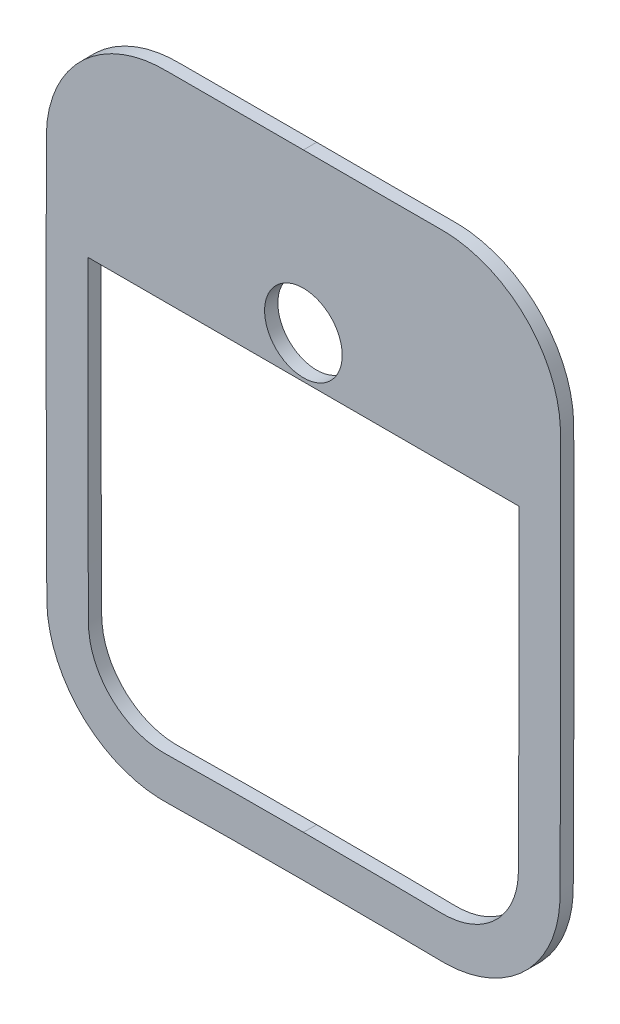
from build123d import *

# Parameters (mm, degrees)
SKETCH_1_R      = 8.2
EXTRUDE_1_DEPTH = 1.4


with BuildPart() as part:
    # Эскиз1 → Бобышка-Вытянуть1 (new, symmetric)
    # profile 1 of 2: a face of its own
    with BuildSketch(Plane.XY):
        with BuildLine():
            add(Edge.make_bspline(
                [(-4.385e-06, 3.477314103), (2.275729164, 3.478174042), (6.827561201, 3.476973512), (13.653105903, 3.440292499), (19.344025952, 3.391861948), (23.890939343, 3.335371796), (26.745660232, 3.303860565), (29.00129781, 3.258870273), (31.368643959, 3.280847467), (34.286491629, 3.648899926), (37.706807786, 4.571513603), (42.042206832, 6.440713344), (46.879953022, 9.901314255), (50.537599605, 14.593753945), (52.579526042, 18.850208453), (53.637220524, 22.234973045), (54.111038279, 25.135298028), (54.225276888, 27.510163809), (54.215390164, 29.778236261), (54.240133301, 32.628290734), (54.257823169, 37.180085377), (54.285075218, 42.87272942), (54.310780929, 49.702787654), (54.339930891, 58.810068537), (54.363104914, 70.194239859), (54.366568245, 81.578467791), (54.358708606, 90.685719503), (54.349162039, 97.516071715), (54.334485436, 103.20797513), (54.328060317, 107.761560094), (54.308811233, 110.606659613), (54.324408142, 112.886642082), (54.194135143, 115.257721943), (53.705013261, 118.157957161), (52.62466034, 121.53452525), (50.554252788, 125.778079082), (46.871486807, 130.445624202), (42.029828738, 133.893421474), (37.700582591, 135.76774794), (34.286491793, 136.703374588), (31.371947713, 137.091049425), (29.008672577, 137.130240387), (26.75376985, 137.112713038), (23.89762622, 137.112770231), (19.349331815, 137.104281948), (13.656648626, 137.103485823), (6.828758745, 137.110737326), (2.276195077, 137.124340079), (1.12e-07, 137.132324706)],
                knots=[-1.403e-06, -1.403e-06, -1.403e-06, -1.403e-06, 0.031249042, 0.062499487, 0.093749932, 0.109375155, 0.125000377, 0.132812988, 0.1406256, 0.156250822, 0.171876045, 0.187501267, 0.218751712, 0.250002158, 0.26562738, 0.281252603, 0.296877825, 0.304690436, 0.312503048, 0.32812827, 0.343753493, 0.375003938, 0.406254383, 0.437504828, 0.500005718, 0.562506609, 0.593757054, 0.625007499, 0.656257944, 0.671883166, 0.687508389, 0.695321, 0.703133611, 0.718758834, 0.734384057, 0.750009279, 0.781259724, 0.812510169, 0.828135392, 0.843760614, 0.859385837, 0.867198448, 0.87501106, 0.890636282, 0.906261505, 0.93751195, 0.968762395, 1.00001284, 1.00001284, 1.00001284, 1.00001284], degree=3))
            add(Edge.make_bspline(
                [(1.12e-07, 137.132324706), (-2.276185426, 137.124340752), (-6.828726159, 137.110744752), (-13.656606089, 137.103457892), (-19.349208462, 137.10436388), (-23.897588817, 137.112625317), (-26.753539522, 137.112932833), (-29.008712264, 137.129920257), (-31.371889119, 137.091250562), (-34.28635234, 136.70332851), (-37.700359545, 135.767848518), (-42.029772945, 133.893467536), (-46.871398793, 130.445729176), (-50.55428945, 125.777966939), (-52.624591575, 121.534611836), (-53.70513162, 118.157582998), (-54.194201592, 115.257651601), (-54.324437606, 112.885963391), (-54.308864544, 110.605865688), (-54.327593372, 107.761624293), (-54.334894059, 103.207477192), (-54.349024698, 97.515902003), (-54.358743316, 90.685462991), (-54.366551769, 81.578292176), (-54.363106097, 70.194087786), (-54.339937065, 58.809981225), (-54.310765845, 49.702710304), (-54.28514198, 42.872756766), (-54.257608847, 37.179931068), (-54.240289723, 32.628480608), (-54.215525939, 29.778361624), (-54.225458708, 27.509257596), (-54.110840518, 25.135839108), (-53.637255477, 22.234868439), (-52.579828848, 18.85130182), (-50.538045421, 14.593912603), (-46.880507021, 9.902159969), (-42.04267942, 6.44089392), (-37.707827157, 4.572078379), (-34.286835279, 3.648708981), (-31.369101111, 3.281392258), (-29.001029802, 3.257925087), (-26.74533221, 3.304228282), (-23.890964379, 3.3355427), (-19.343908429, 3.391749693), (-13.653071795, 3.440339679), (-6.827524402, 3.476942091), (-2.27572566, 3.478198986), (-4.385e-06, 3.477314103)],
                knots=[-1.284e-05, -1.284e-05, -1.284e-05, -1.284e-05, 0.031237605, 0.06248805, 0.093738495, 0.109363718, 0.12498894, 0.132801552, 0.140614163, 0.156239386, 0.171864608, 0.187489831, 0.218740276, 0.249990721, 0.265615943, 0.281241166, 0.296866388, 0.304679, 0.312491611, 0.328116834, 0.343742056, 0.374992501, 0.406242946, 0.437493391, 0.499994282, 0.562495172, 0.593745617, 0.624996062, 0.656246507, 0.67187173, 0.687496952, 0.695309564, 0.703122175, 0.718747397, 0.73437262, 0.749997842, 0.781248288, 0.812498733, 0.828123955, 0.843749178, 0.8593744, 0.867187012, 0.874999623, 0.890624845, 0.906250068, 0.937500513, 0.968750958, 1.000001403, 1.000001403, 1.000001403, 1.000001403], degree=3))
        make_face()
        with BuildLine():
            add(Edge.make_bspline(
                [(-1.124e-06, 128.332270568), (-2.280365613, 128.324272059), (-6.840952372, 128.310772668), (-12.54247003, 128.304473477), (-17.102470136, 128.304321449), (-20.523264106, 128.306743989), (-23.37067067, 128.310496061), (-25.368903885, 128.314343862), (-26.506742002, 128.316832808), (-27.361014138, 128.318797865), (-28.203886411, 128.319851575), (-29.119861379, 128.324220631), (-29.70669642, 128.321454641), (-30.265835712, 128.296280345), (-30.849635682, 128.251162802), (-31.608716707, 128.165017173), (-32.932970792, 127.945188977), (-34.786653205, 127.432872726), (-37.598941607, 126.212459438), (-40.736488176, 123.97204058), (-43.108216264, 120.957761098), (-44.436395269, 118.228034571), (-45.012424743, 116.423394489), (-45.313137049, 114.948092229), (-45.4341262, 114.012134472), (-45.482929754, 113.359443212), (-45.501430806, 112.970994029), (-45.509004812, 112.716591942), (-45.511850815, 112.415737461), (-45.51321122, 111.83855637), (-45.516326707, 110.848732037), (-45.520207457, 109.423684892), (-45.524886348, 107.718360637), (-45.529308036, 106.011951146), (-45.534915418, 103.737254487), (-45.541323411, 100.893798883), (-45.547051991, 97.981927915), (-45.551113999, 95.638800098), (-45.554681534, 93.364239297), (-45.559909161, 89.452403461), (-45.564581633, 83.835093852), (-45.565131683, 77.01255514), (-45.56014737, 70.190613462), (-45.549187131, 63.368807037), (-45.532605469, 56.546287339), (-45.51095078, 49.723370217), (-45.488946454, 44.036906078), (-45.469532783, 39.487306664), (-45.456465453, 36.644300231), (-45.445643146, 34.368669525), (-45.437598421, 32.660679006), (-45.429344739, 30.956269573), (-45.422435335, 29.532980428), (-45.41634537, 28.546524613), (-45.414260609, 27.949648431), (-45.411606391, 27.619401141), (-45.404807721, 27.357013936), (-45.388233834, 26.977548221), (-45.354533552, 26.502908376), (-45.294452504, 25.939793742), (-45.187260504, 25.19126516), (-44.930020155, 23.896193536), (-44.361798981, 22.083233355), (-43.051533958, 19.352124321), (-40.699860395, 16.336632861), (-37.592385393, 14.113257477), (-34.796945869, 12.908970494), (-32.958645932, 12.411113504), (-31.457545368, 12.172674769), (-30.509178938, 12.089466262), (-29.730359526, 12.062276053), (-29.193216609, 12.063494106), (-28.263522102, 12.079294928), (-27.434540192, 12.089709292), (-26.572157763, 12.102080156), (-25.431420464, 12.117338956), (-23.432628028, 12.143240858), (-20.575428896, 12.176885748), (-17.145071926, 12.210392531), (-12.574540631, 12.246517778), (-6.853060233, 12.276830286), (-2.285093032, 12.278203292), (4.3852e-05, 12.277314749)],
                knots=[0.000128398, 0.000128398, 0.000128398, 0.000128398, 0.031373947, 0.062619496, 0.078242271, 0.093865045, 0.10948782, 0.117299207, 0.121204901, 0.125110594, 0.129016288, 0.132921981, 0.136827675, 0.140733369, 0.144639062, 0.148544756, 0.156356143, 0.171978918, 0.187601692, 0.218847241, 0.25009279, 0.265715565, 0.281338339, 0.289149727, 0.296961114, 0.300866808, 0.302819654, 0.304772501, 0.306725348, 0.308678195, 0.312583888, 0.320395276, 0.328206663, 0.33601805, 0.343829438, 0.359452212, 0.375074987, 0.383827423, 0.39163881, 0.406320536, 0.437566085, 0.468811634, 0.500057183, 0.531302732, 0.562548281, 0.59379383, 0.625039379, 0.640662153, 0.656284928, 0.664096315, 0.671907702, 0.67971909, 0.687530477, 0.691436171, 0.693389017, 0.695341864, 0.697294711, 0.699247558, 0.703153252, 0.707058945, 0.710964639, 0.718776026, 0.734398801, 0.750021575, 0.781267124, 0.812512673, 0.828135448, 0.843758222, 0.85156961, 0.859380997, 0.86328669, 0.867192384, 0.871098078, 0.875003771, 0.878909465, 0.882815159, 0.890626546, 0.90624932, 0.921872095, 0.937494869, 0.968740418, 0.999985967, 0.999985967, 0.999985967, 0.999985967], degree=3))
            add(Edge.make_bspline(
                [(4.3852e-05, 12.277314749), (2.285162037, 12.278178233), (6.852999241, 12.276845673), (12.574780006, 12.246527878), (17.144985532, 12.210363417), (20.57569713, 12.176960899), (23.433312535, 12.143051028), (25.716980218, 12.113426772), (27.140984834, 12.094162805), (28.141948342, 12.080243259), (28.707509406, 12.072365423), (29.144777213, 12.066017361), (29.476675101, 12.062739773), (29.817107194, 12.065696461), (30.521796099, 12.089763222), (31.452436483, 12.172300681), (32.960678016, 12.411176925), (34.796642749, 12.908964458), (37.591392073, 14.112620477), (40.700637936, 16.337218605), (43.050825935, 19.35121204), (44.362176077, 22.084041317), (44.929883293, 23.895422674), (45.187217236, 25.191275305), (45.294501204, 25.939930113), (45.354705043, 26.504366914), (45.387889545, 26.972290872), (45.405059364, 27.364177233), (45.413240328, 27.683316219), (45.415799251, 28.395043811), (45.422022514, 29.534933442), (45.428982033, 30.95585276), (45.437509171, 32.662642148), (45.445759921, 34.368766068), (45.456525412, 36.643809272), (45.469473565, 39.487436534), (45.48898664, 44.036974024), (45.510934389, 49.723402735), (45.532612108, 56.546389251), (45.549184449, 63.368909379), (45.560149235, 70.190787678), (45.565134972, 77.012700732), (45.564573999, 83.835332377), (45.559921529, 89.452484984), (45.554670844, 93.364286454), (45.551100873, 95.638901177), (45.547050347, 97.982202578), (45.541396621, 100.894087853), (45.5348061, 103.73693879), (45.529249909, 106.01313671), (45.525140597, 107.720175361), (45.520727736, 109.424953224), (45.51689783, 110.701716875), (45.513949572, 111.552928056), (45.512740179, 111.997170575), (45.512216342, 112.410213075), (45.509018702, 112.71228653), (45.501259118, 112.975509318), (45.483140503, 113.355655776), (45.433813854, 114.015917573), (45.31325126, 114.947050304), (45.012334203, 116.42398517), (44.436238669, 118.228401606), (43.108372135, 120.9575061), (40.736358501, 123.972304678), (37.598780876, 126.212315612), (34.787277504, 127.432890858), (32.931013426, 127.945183015), (31.423213031, 128.19637169), (30.459166299, 128.287744026), (29.701656747, 128.321457656), (29.122512149, 128.324558111), (28.204573456, 128.319655895), (27.360122909, 128.318846834), (26.508824285, 128.316732451), (25.366555006, 128.31421329), (23.372775527, 128.310673305), (20.522587126, 128.306685929), (17.102750116, 128.304334186), (12.542392855, 128.304466124), (6.841024451, 128.310775925), (2.280372778, 128.324271385), (-1.124e-06, 128.332270568)],
                knots=[1.4032e-05, 1.4032e-05, 1.4032e-05, 1.4032e-05, 0.031259582, 0.062505131, 0.078127905, 0.09375068, 0.109373454, 0.117184841, 0.124996229, 0.128901922, 0.130854769, 0.132807616, 0.134760463, 0.13671331, 0.140619003, 0.148430391, 0.156241778, 0.171864552, 0.187487327, 0.218732876, 0.249978425, 0.2656012, 0.281223974, 0.289035361, 0.292941055, 0.296846749, 0.300752442, 0.302705289, 0.304658136, 0.308563829, 0.312469523, 0.32028091, 0.328092298, 0.335903685, 0.343715072, 0.359337847, 0.374960621, 0.40620617, 0.437451719, 0.468697268, 0.499942817, 0.531188367, 0.562433916, 0.593679465, 0.60836009, 0.616171478, 0.624925014, 0.640547788, 0.656170563, 0.66398195, 0.671793337, 0.679604725, 0.687416112, 0.689368959, 0.691321806, 0.693274652, 0.695227499, 0.697180346, 0.699133193, 0.703038886, 0.710850274, 0.718661661, 0.734284435, 0.74990721, 0.781152759, 0.812398308, 0.828021083, 0.843643857, 0.851455244, 0.859266632, 0.863172325, 0.867078019, 0.870983713, 0.874889406, 0.8787951, 0.882700794, 0.890512181, 0.906134955, 0.92175773, 0.937380504, 0.968626053, 0.999871603, 0.999871603, 0.999871603, 0.999871603], degree=3))
        make_face(mode=Mode.SUBTRACT)
    # profile 2 of 2: a face of its own
    with BuildSketch(Plane.XY):
        with BuildLine():
            add(Edge.make_bspline(
                [(-1.124e-06, 128.332270568), (-2.280365613, 128.324272059), (-6.840952372, 128.310772668), (-12.54247003, 128.304473477), (-17.102470136, 128.304321449), (-20.523264106, 128.306743989), (-23.37067067, 128.310496061), (-25.368903885, 128.314343862), (-26.506742002, 128.316832808), (-27.361014138, 128.318797865), (-28.203886411, 128.319851575), (-29.119861379, 128.324220631), (-29.70669642, 128.321454641), (-30.265835712, 128.296280345), (-30.849635682, 128.251162802), (-31.608716707, 128.165017173), (-32.932970792, 127.945188977), (-34.786653205, 127.432872726), (-37.598941607, 126.212459438), (-40.736488176, 123.97204058), (-43.108216264, 120.957761098), (-44.436395269, 118.228034571), (-45.012424743, 116.423394489), (-45.313137049, 114.948092229), (-45.4341262, 114.012134472), (-45.482929754, 113.359443212), (-45.501430806, 112.970994029), (-45.509004812, 112.716591942), (-45.511850815, 112.415737461), (-45.51321122, 111.83855637), (-45.516326707, 110.848732037), (-45.520207457, 109.423684892), (-45.524886348, 107.718360637), (-45.529308036, 106.011951146), (-45.534915418, 103.737254487), (-45.541323411, 100.893798883), (-45.547051991, 97.981927915), (-45.550621094, 95.923127736), (-45.552102256, 95.001656782), (-45.552548004, 94.717336681)],
                knots=[0.000128398, 0.000128398, 0.000128398, 0.000128398, 0.031373947, 0.062619496, 0.078242271, 0.093865045, 0.10948782, 0.117299207, 0.121204901, 0.125110594, 0.129016288, 0.132921981, 0.136827675, 0.140733369, 0.144639062, 0.148544756, 0.156356143, 0.171978918, 0.187601692, 0.218847241, 0.25009279, 0.265715565, 0.281338339, 0.289149727, 0.296961114, 0.300866808, 0.302819654, 0.304772501, 0.306725348, 0.308678195, 0.312583888, 0.320395276, 0.328206663, 0.33601805, 0.343829438, 0.359452212, 0.375074987, 0.383827423, 0.387733116, 0.387733116, 0.387733116, 0.387733116], degree=3))
            Line((-45.552548004, 94.717336681), (45.552536312, 94.717336681))
            add(Edge.make_bspline(
                [(45.552536312, 94.717336681), (45.552090342, 95.001663768), (45.550609377, 95.923240162), (45.547050347, 97.982202578), (45.541396621, 100.894087853), (45.5348061, 103.73693879), (45.529249909, 106.01313671), (45.525140597, 107.720175361), (45.520727736, 109.424953224), (45.51689783, 110.701716875), (45.513949572, 111.552928056), (45.512740179, 111.997170575), (45.512216342, 112.410213075), (45.509018702, 112.71228653), (45.501259118, 112.975509318), (45.483140503, 113.355655776), (45.433813854, 114.015917573), (45.31325126, 114.947050304), (45.012334203, 116.42398517), (44.436238669, 118.228401606), (43.108372135, 120.9575061), (40.736358501, 123.972304678), (37.598780876, 126.212315612), (34.787277504, 127.432890858), (32.931013426, 127.945183015), (31.423213031, 128.19637169), (30.459166299, 128.287744026), (29.701656747, 128.321457656), (29.122512149, 128.324558111), (28.204573456, 128.319655895), (27.360122909, 128.318846834), (26.508824285, 128.316732451), (25.366555006, 128.31421329), (23.372775527, 128.310673305), (20.522587126, 128.306685929), (17.102750116, 128.304334186), (12.542392855, 128.304466124), (6.841024451, 128.310775925), (2.280372778, 128.324271385), (-1.124e-06, 128.332270568)],
                knots=[0.612265784, 0.612265784, 0.612265784, 0.612265784, 0.616171478, 0.624925014, 0.640547788, 0.656170563, 0.66398195, 0.671793337, 0.679604725, 0.687416112, 0.689368959, 0.691321806, 0.693274652, 0.695227499, 0.697180346, 0.699133193, 0.703038886, 0.710850274, 0.718661661, 0.734284435, 0.74990721, 0.781152759, 0.812398308, 0.828021083, 0.843643857, 0.851455244, 0.859266632, 0.863172325, 0.867078019, 0.870983713, 0.874889406, 0.8787951, 0.882700794, 0.890512181, 0.906134955, 0.92175773, 0.937380504, 0.968626053, 0.999871603, 0.999871603, 0.999871603, 0.999871603], degree=3))
        make_face()
        with Locations((0, 103.636945021)):
            Circle(SKETCH_1_R, mode=Mode.SUBTRACT)
    extrude(amount=EXTRUDE_1_DEPTH, both=True)


solid = part.part
